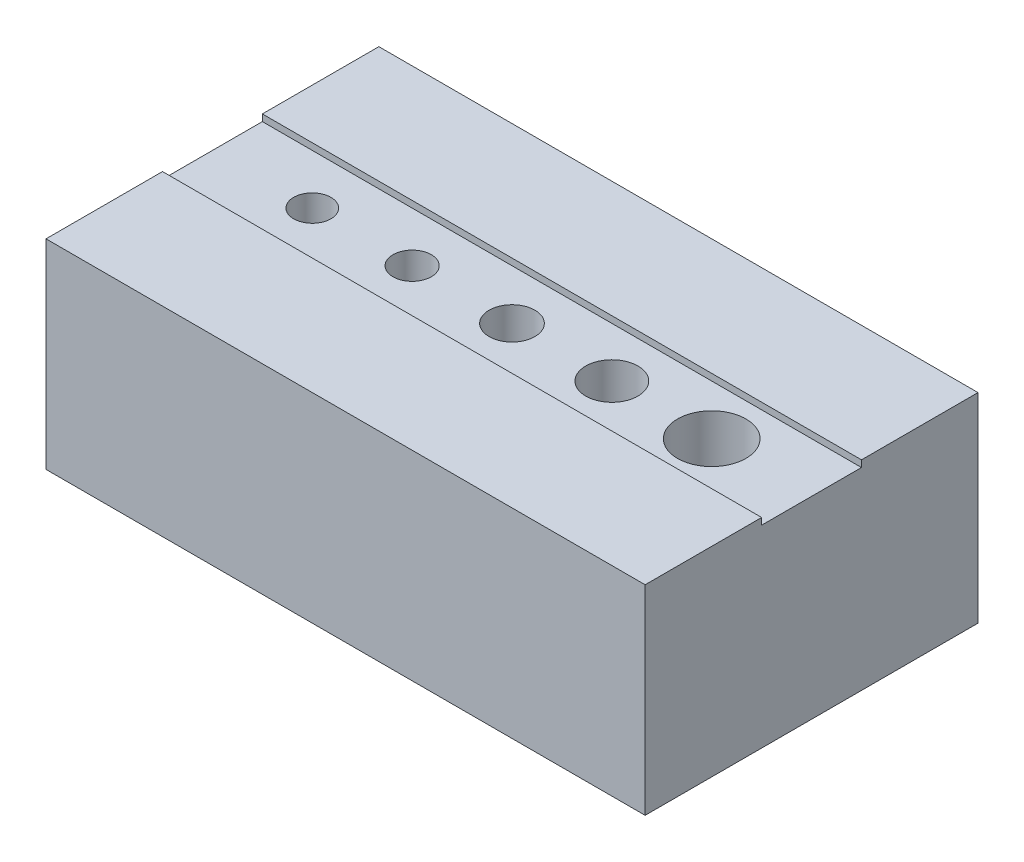
from build123d import *

# Parameters (mm, degrees)
SKETCH1_W           = 57.15
SKETCH1_H           = 31.75
BOSS_EXTRUDE1_DEPTH = 19.05
SKETCH2_W           = 57.15
SKETCH2_H           = 9.525
CUT_EXTRUDE1_DEPTH  = 0.635
SKETCH3_R           = 1.778
SKETCH3_R_2         = 1.8288
SKETCH3_R_3         = 2.1844
SKETCH3_R_4         = 2.4892
SKETCH3_R_5         = 3.2639
CUT_EXTRUDE2_DEPTH  = 38.518774967


with BuildPart() as part:
    # Sketch1 → Boss-Extrude1 (new body)
    with BuildSketch(Plane(origin=(0, 0, 0), x_dir=(1, 0, 0), z_dir=(0, 1, 0))):
        Rectangle(SKETCH1_W, SKETCH1_H)
    extrude(amount=BOSS_EXTRUDE1_DEPTH)

    # Sketch2 → Cut-Extrude1 (cut)
    with BuildSketch(Plane(origin=(0, 19.05, 0), x_dir=(1, 0, 0), z_dir=(0, 1, 0))):
        Rectangle(SKETCH2_W, SKETCH2_H)
    extrude(amount=-CUT_EXTRUDE1_DEPTH, mode=Mode.SUBTRACT)

    # Sketch3 → Cut-Extrude2 (cut, through all)
    with BuildSketch(Plane(origin=(0, 18.415, 0), x_dir=(1, 0, 0), z_dir=(0, 1, 0))):
        with Locations(Location((-19.05, 0, 0), (0, 0, 270))):
            Circle(SKETCH3_R)
        with Locations(Location((-9.525, 0, 0), (0, 0, 270))):
            Circle(SKETCH3_R_2)
        with Locations(Location((0, 0, 0), (0, 0, 270))):
            Circle(SKETCH3_R_3)
        with Locations(Location((9.525, 0, 0), (0, 0, 270))):
            Circle(SKETCH3_R_4)
        with Locations(Location((19.05, 0, 0), (0, 0, 270))):
            Circle(SKETCH3_R_5)
    extrude(amount=-CUT_EXTRUDE2_DEPTH, mode=Mode.SUBTRACT)


solid = part.part
